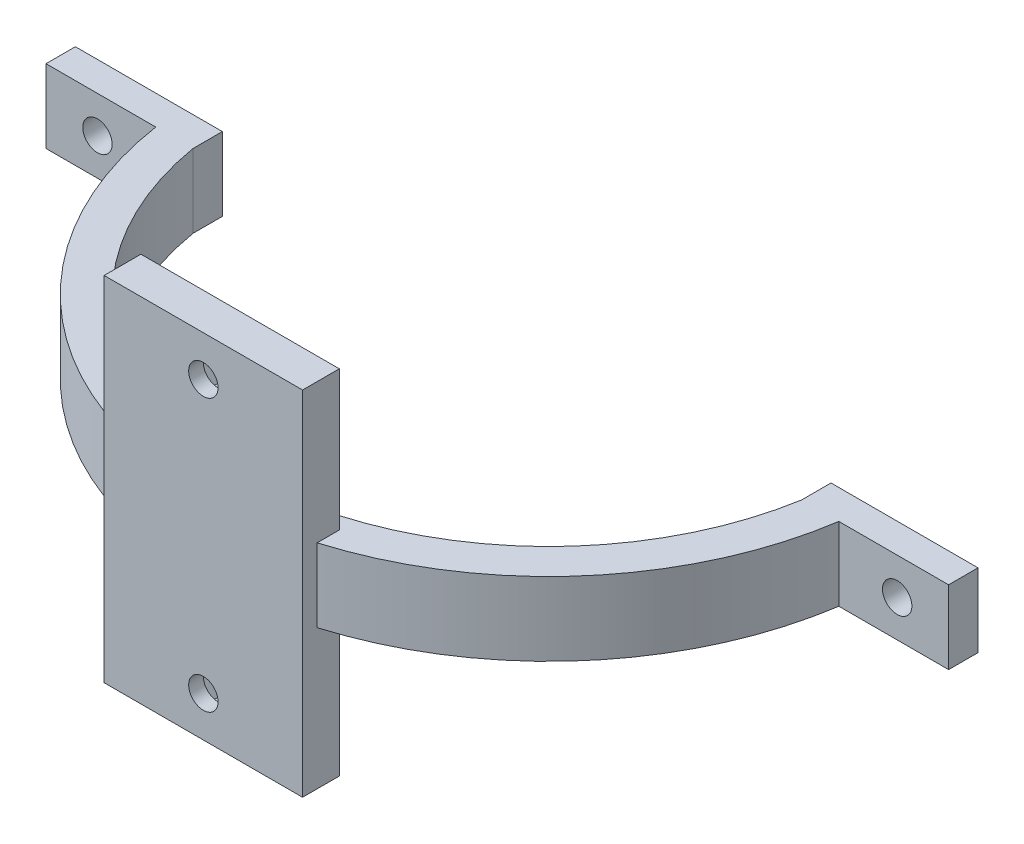
from build123d import *

# Parameters (mm, degrees)
EXTRUDE_1_DEPTH           = 10
SKETCH_2_W                = 27
SKETCH_2_H                = 10
EXTRUDE_2_DEPTH           = 1.980559755
SKETCH_3_W                = 122.825116964
SKETCH_3_H                = 10
EXTRUDE_3_DEPTH           = 4
SKETCH_4_W                = 27
SKETCH_4_H                = 5
EXTRUDE_4_DEPTH           = 19
CUT_EXTRUDE_1_DEPTH       = 83.592386691
SKETCH_6_W                = 27
SKETCH_6_H                = 5
EXTRUDE_5_DEPTH           = 19
CUT_EXTRUDE_2_DEPTH       = 3
CUT_EXTRUDE_3_DEPTH       = 3
HOLE_WIZARD_4_0_4_1_D     = 4
HOLE_WIZARD_4_0_4_1_DEPTH = 44
HOLE_WIZARD_4_0_4_2_D     = 4


with BuildPart() as part:
    # Эскиз1 → Бобышка-Вытянуть1 (new body)
    with BuildSketch(Plane(origin=(0, 10, 0), x_dir=(1, 0, 0), z_dir=(0, 1, 0))):
        with BuildLine():
            Line((-13.5, -45.019440245), (13.5, -45.019440245))
            ThreePointArc((13.5, -45.019440245), (35.505543373, -30.795395594), (46.475800154, -7))
            Line((46.475800154, -7), (-46.475800154, -7))
            ThreePointArc((-46.475800154, -7), (-35.505543373, -30.795395594), (-13.5, -45.019440245))
        make_face()
    extrude(amount=-EXTRUDE_1_DEPTH)

    # Эскиз2 → Бобышка-Вытянуть2 (add)
    with BuildSketch(Plane.XY.offset(45.019440245)):
        with Locations((0, 5)):
            Rectangle(SKETCH_2_W, SKETCH_2_H)
    extrude(amount=EXTRUDE_2_DEPTH)

    # Эскиз3 → Бобышка-Вытянуть3 (add)
    with BuildSketch(Plane(origin=(0, 0, 7), x_dir=(-1, 0, 0), z_dir=(0, 0, -1))):
        with Locations((0, 5)):
            Rectangle(SKETCH_3_W, SKETCH_3_H)
    extrude(amount=EXTRUDE_3_DEPTH)

    # Эскиз4 → Бобышка-Вытянуть4 (add)
    with BuildSketch(Plane.XZ):
        with Locations((0, 44.5)):
            Rectangle(SKETCH_4_W, SKETCH_4_H)
    extrude(amount=EXTRUDE_4_DEPTH)

    # Эскиз5 → Вырез-Вытянуть1 (cut, through all)
    with BuildSketch(Plane(origin=(0, 10, 0), x_dir=(-1, 0, 0), z_dir=(0, 1, 0))):
        with BuildLine():
            Line((-41.412558482, 3), (41.412558482, 3))
            Line((41.412558482, 3), (41.412558482, 7))
            ThreePointArc((41.412558482, 7), (0, 42), (-41.412558482, 7))
            Line((-41.412558482, 7), (-41.412558482, 3))
        make_face()
    extrude(amount=-CUT_EXTRUDE_1_DEPTH, mode=Mode.SUBTRACT)

    # Эскиз6 → Бобышка-Вытянуть5 (add)
    with BuildSketch(Plane(origin=(0, 10, 0), x_dir=(-1, 0, 0), z_dir=(0, 1, 0))):
        with Locations((0, 44.5)):
            Rectangle(SKETCH_6_W, SKETCH_6_H)
    extrude(amount=EXTRUDE_5_DEPTH)

    # Эскиз7 → Вырез-Вытянуть2 (cut)
    with BuildSketch(Plane(origin=(0, 0, 42), x_dir=(-1, 0, 0), z_dir=(0, 0, -1))):
        Polygon((1.991858429, 26.95), (-1.991858429, 26.95), (-3.983716857, 23.5), (-1.991858429, 20.05), (1.991858429, 20.05), (3.983716857, 23.5), align=None)
    extrude(amount=-CUT_EXTRUDE_2_DEPTH, mode=Mode.SUBTRACT)

    # Эскиз8 → Вырез-Вытянуть3 (cut)
    with BuildSketch(Plane(origin=(0, 0, 42), x_dir=(-1, 0, 0), z_dir=(0, 0, -1))):
        Polygon((1.991858429, -10.05), (-1.991858429, -10.05), (-3.983716857, -13.5), (-1.991858429, -16.95), (1.991858429, -16.95), (3.983716857, -13.5), align=None)
    extrude(amount=-CUT_EXTRUDE_3_DEPTH, mode=Mode.SUBTRACT)

    # Диаметр отверстия Ø4.0 (4)1
    with Locations(Plane.XY.offset(47)):
        with Locations((0, 23.5), (0, -13.5)):
            Hole(HOLE_WIZARD_4_0_4_1_D / 2, depth=HOLE_WIZARD_4_0_4_1_DEPTH)

    # Диаметр отверстия Ø4.0 (4)2 (through all)
    with Locations(Plane.XY.offset(7)):
        with Locations((-54.412558482, 5), (54.412558482, 5)):
            Hole(HOLE_WIZARD_4_0_4_2_D / 2)


solid = part.part
